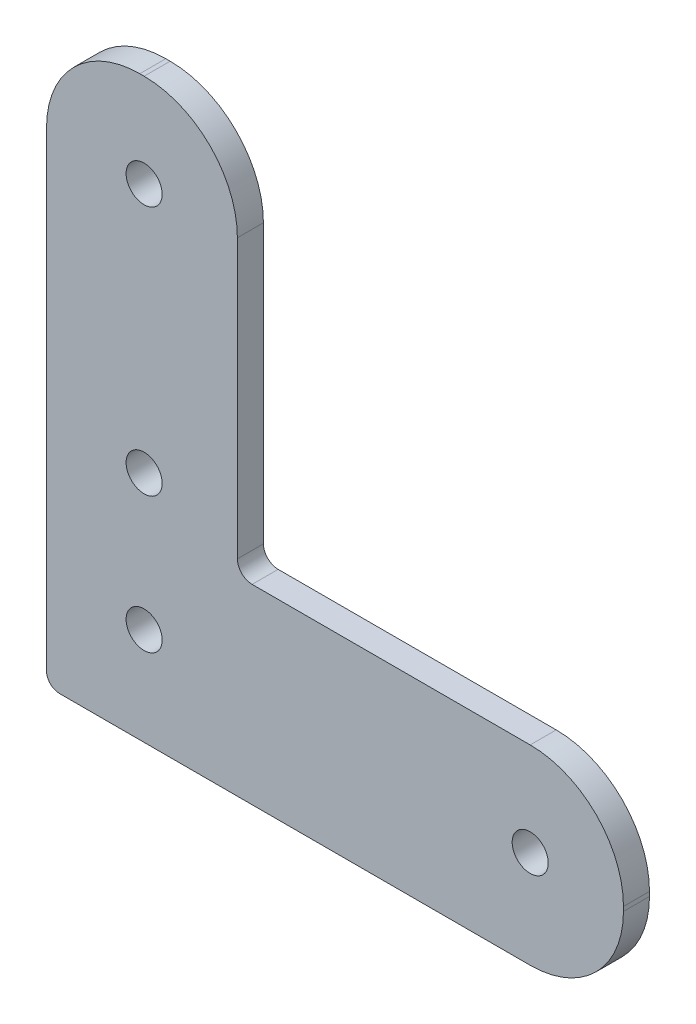
from build123d import *

# Parameters (mm, degrees)
BOSS_EXTRUDE1_DEPTH      = 3
FILLET4_R                = 21.5
FILLET5_R                = 3.4
FILLET6_R                = 3
F_5_16_CLEARANCE_HOLE1_D = 8.3185


with BuildPart() as part:
    # Sketch1 → Boss-Extrude1 (new, symmetric)
    with BuildSketch(Plane.XY):
        Polygon((0, 133), (0, 0), (133, 0), (133, 44), (44, 44), (44, 133), align=None)
    extrude(amount=BOSS_EXTRUDE1_DEPTH, both=True)

    # Fillet4
    fillet4_edges = [part.edges().sort_by_distance(p)[0] for p in [
        (133, 44, 0),
        (133, 0, 0),
        (0, 133, 0),
        (44, 133, 0),
    ]]
    fillet(fillet4_edges, radius=FILLET4_R)

    # Fillet5
    fillet5_edges = [part.edges().sort_by_distance(p)[0] for p in [
        (44, 44, 0),
    ]]
    fillet(fillet5_edges, radius=FILLET5_R)

    # Fillet6
    fillet6_edges = [part.edges().sort_by_distance(p)[0] for p in [
        (0, 0, 0),
    ]]
    fillet(fillet6_edges, radius=FILLET6_R)

    # 5/16 Clearance Hole1 (through all)
    with Locations(Plane.XY.offset(3)):
        with Locations((22.5, 111.5), (22.5, 53.7884), (22.5, 22.5), (111.5, 22.5)):
            Hole(F_5_16_CLEARANCE_HOLE1_D / 2)


solid = part.part
